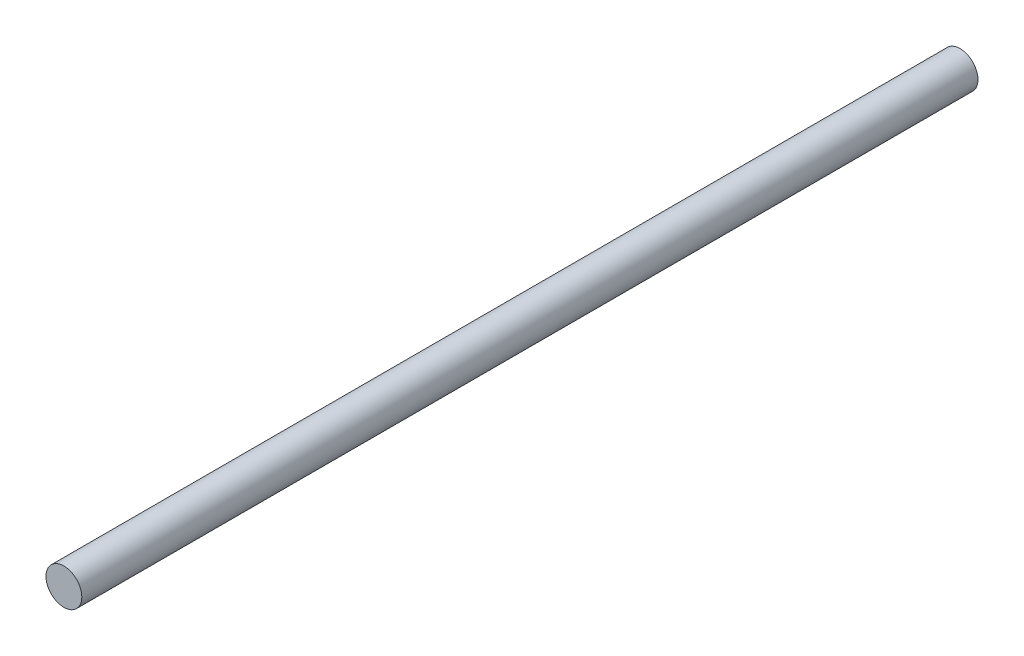
from build123d import *

# Parameters (mm, degrees)
SKETCH1_R           = 20
BOSS_EXTRUDE1_DEPTH = 1000


with BuildPart() as part:
    # Sketch1 → Boss-Extrude1 (new body)
    with BuildSketch(Plane.XY):
        Circle(SKETCH1_R)
    extrude(amount=BOSS_EXTRUDE1_DEPTH)


solid = part.part
